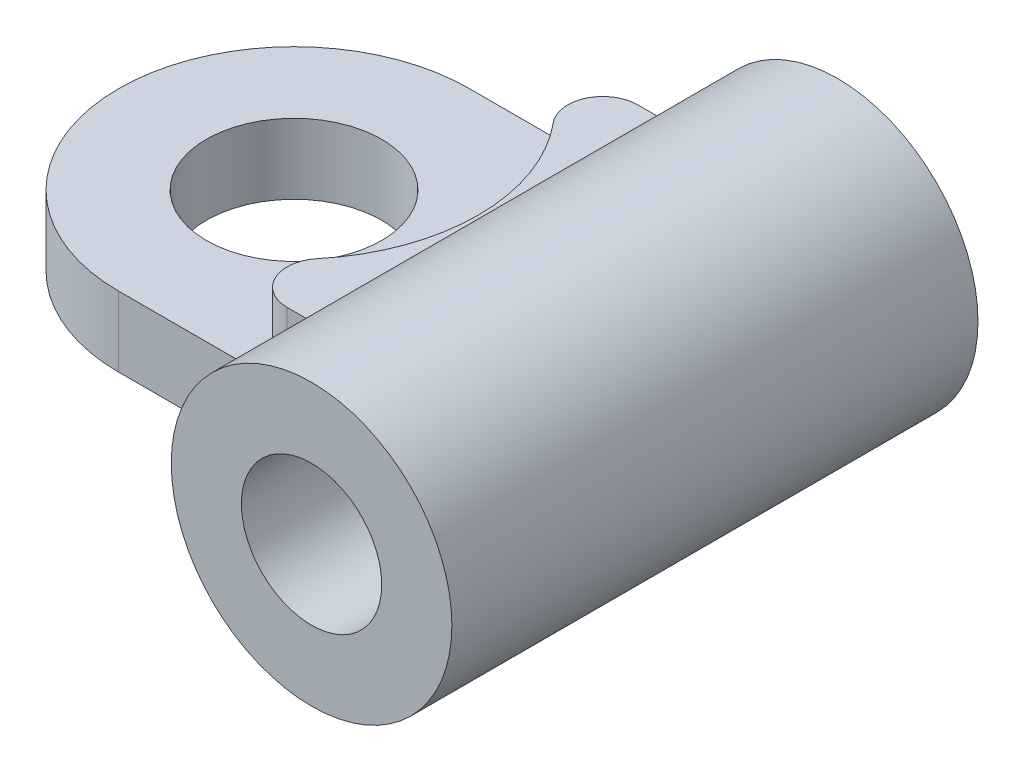
from build123d import *

# Parameters (mm, degrees)
SKETCH1_R           = 8
SKETCH1_R_2         = 4
BOSS_EXTRUDE1_DEPTH = 30
BOSS_EXTRUDE2_DEPTH = 4
SKETCH3_R           = 10.5
CUT_EXTRUDE1_DEPTH  = 4
FILLET1_R           = 2
SKETCH4_R           = 5
CUT_EXTRUDE2_DEPTH  = 4


with BuildPart() as part:
    # Sketch1 → Boss-Extrude1 (new body)
    with BuildSketch(Plane.XY):
        Circle(SKETCH1_R)
        Circle(SKETCH1_R_2, mode=Mode.SUBTRACT)
    extrude(amount=BOSS_EXTRUDE1_DEPTH)


with BuildPart() as body_2:
    # Sketch2 → Boss-Extrude2 (new, symmetric)
    with BuildSketch(Plane(origin=(0, 0, 0), x_dir=(1, 0, 0), z_dir=(0, 1, 0))):
        with BuildLine():
            Line((-5, -3), (-18, -3))
            ThreePointArc((-18, -3), (-28, -13), (-18, -23))
            Line((-18, -23), (-5, -23))
            Line((-5, -23), (-5, -3))
        make_face()
    extrude(amount=BOSS_EXTRUDE2_DEPTH, both=True)


with BuildPart() as cut_extrude1_tool:
    # Sketch3 → Cut-Extrude1 (new body)
    with BuildSketch(Plane(origin=(0, 4, 0), x_dir=(1, 0, 0), z_dir=(0, 1, 0))):
        with Locations((-18, -13)):
            Circle(SKETCH3_R)
    extrude(amount=-CUT_EXTRUDE1_DEPTH)


with BuildPart() as part_1:
    add(part.part)

    # Cut-Extrude1: cut by cut_extrude1_tool
    add(cut_extrude1_tool.part, mode=Mode.SUBTRACT)


with BuildPart() as body_2_1:
    add(body_2.part)

    # Cut-Extrude1: cut by cut_extrude1_tool
    add(cut_extrude1_tool.part, mode=Mode.SUBTRACT)

    # Fillet1
    fillet1_edges = [body_2_1.edges().sort_by_distance(p)[0] for p in [
        (-14.798437881, 2, 23),
        (-14.798437881, 2, 3),
    ]]
    fillet(fillet1_edges, radius=FILLET1_R)

    # Sketch4 → Cut-Extrude2 (cut)
    with BuildSketch(Plane(origin=(0, 0, 0), x_dir=(1, 0, 0), z_dir=(0, 1, 0))):
        with Locations(Location((-18, -13, 0), (0, 0, 270))):
            Circle(SKETCH4_R)
    extrude(amount=-CUT_EXTRUDE2_DEPTH, mode=Mode.SUBTRACT)


solid = Compound([part_1.part, body_2_1.part])
